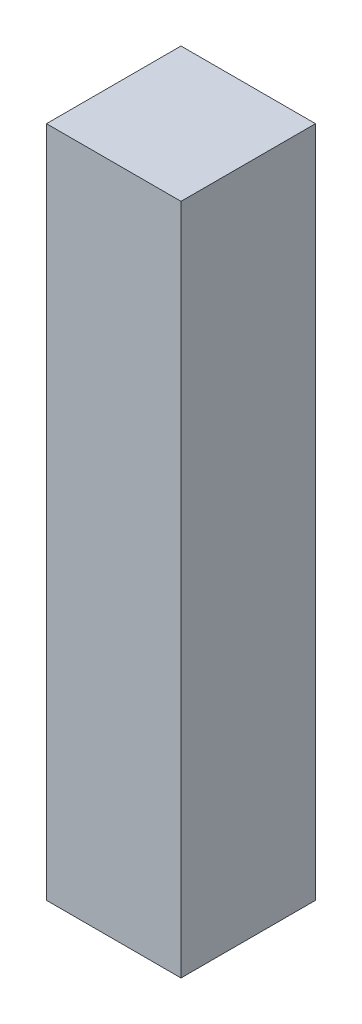
from build123d import *

# Parameters (mm, degrees)
SKIZZE2_W                       = 20
SKIZZE2_H                       = 20
AUFSATZ_LINEAR_AUSTRAGEN1_DEPTH = 100


with BuildPart() as part:
    # Skizze2 → Aufsatz-Linear austragen1 (new body)
    with BuildSketch(Plane(origin=(0, 0, 0), x_dir=(1, 0, 0), z_dir=(0, 1, 0))):
        Rectangle(SKIZZE2_W, SKIZZE2_H)
    extrude(amount=AUFSATZ_LINEAR_AUSTRAGEN1_DEPTH)


solid = part.part
